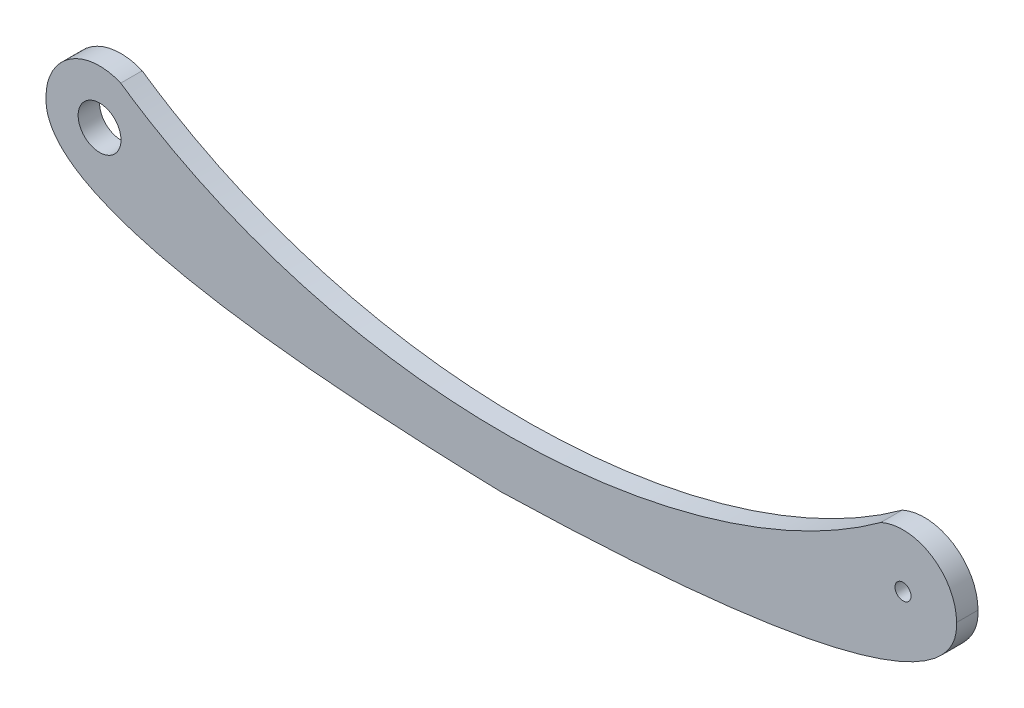
from build123d import *

# Parameters (mm, degrees)
SKETCH_1_R      = 4
SKETCH_1_R_2    = 1.5
EXTRUDE_1_DEPTH = 4


with BuildPart() as part:
    # 草图1 → 凸台-拉伸1 (new body)
    with BuildSketch(Plane.XY):
        with BuildLine():
            ThreePointArc((3.948047826, 9.187650318), (-5.50088728, 8.351062156), (-10, 0))
            add(Edge.make_bspline(
                [(-10, 0), (-10.890214237, -19.135341361), (75, -21.401956932)],
                knots=[0, 0, 0, 1, 1, 1], degree=2))
            add(Edge.make_bspline(
                [(160, 0), (160.890214237, -19.135341361), (75, -21.401956932)],
                knots=[0, 0, 0, 1, 1, 1], degree=2))
            ThreePointArc((160, 0), (155.415713455, 8.40654791), (145.865990446, 9.105490926))
            add(Edge.make_bspline(
                [(3.948047826, 9.187650318), (46.906488456, -20.373746255), (110.551742639, -16.70704022), (145.865990446, 9.105490926)],
                knots=[0.022448948, 0.022448948, 0.022448948, 0.022448948, 0.850781246, 0.850781246, 0.850781246, 0.850781246], degree=3))
        make_face()
        Circle(SKETCH_1_R, mode=Mode.SUBTRACT)
        with Locations((150, 0)):
            Circle(SKETCH_1_R_2, mode=Mode.SUBTRACT)
    extrude(amount=EXTRUDE_1_DEPTH)


solid = part.part
